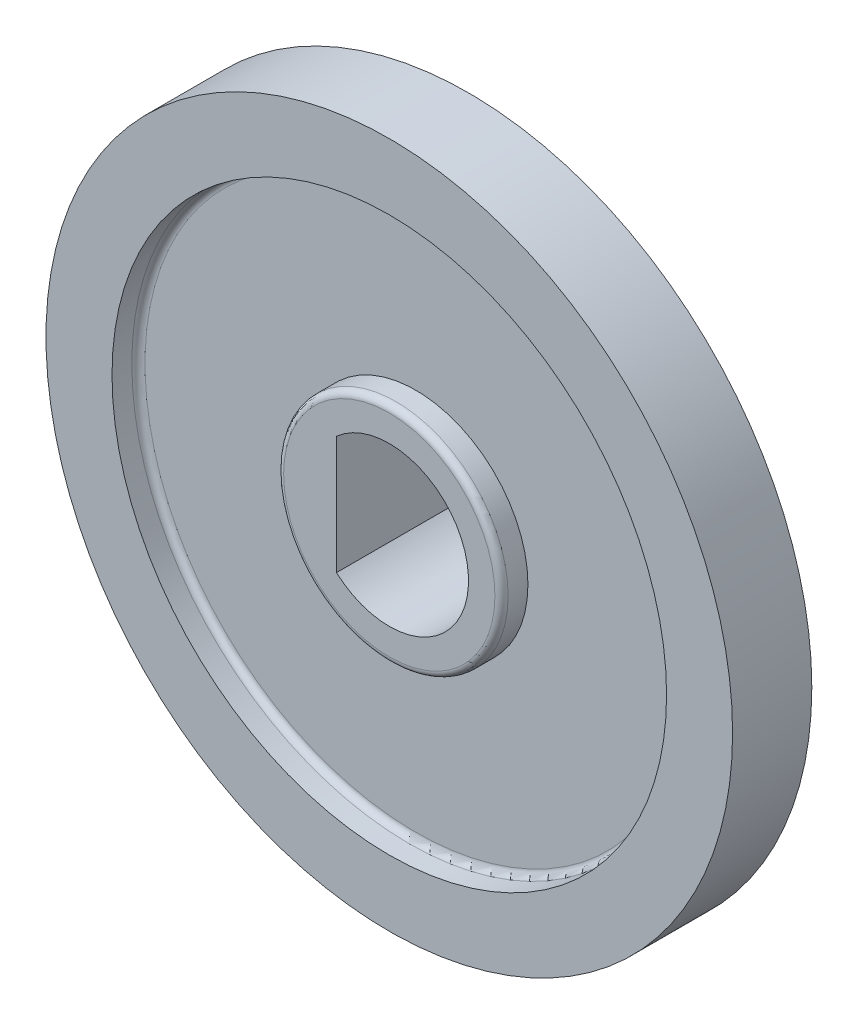
from build123d import *

# Parameters (mm, degrees)
BOSS_EXTRU_1_DEPTH      = 3
ESQUISSE2_R             = 10.5
ESQUISSE2_R_2           = 4.25
ENL_V_MAT_EXTRU_1_DEPTH = 1
ESQUISSE3_R             = 4.25
BOSS_EXTRU_2_DEPTH      = 3.3
BOSS_EXTRU_3_DEPTH      = 1.75
CONG_1_R                = 0.25
BOSS_EXTRU_4_START      = -3
ESQUISSE5_R             = 13
ESQUISSE5_R_2           = 11.875
BOSS_EXTRU_4_DEPTH      = 3


with BuildPart() as part:
    # Esquisse1 → Boss.-Extru.1 (new body)
    with BuildSketch(Plane.XY):
        with BuildLine():
            ThreePointArc((12.99358489, 0.408352439), (12.986055843, 0.601958181), (12.975642211, 0.795430209))
            add(Edge.make_bspline(
                [(11.825183943, 1.086577062), (11.84274004, 1.085334297), (12.058734776, 1.065812313), (12.434577724, 0.990975057), (12.793560897, 0.867739829), (12.961964929, 0.800917402), (12.975642211, 0.795430209)],
                knots=[0.129627803, 0.129627803, 0.129627803, 0.129627803, 0.182246376, 0.777177078, 1.275526536, 1.319644943, 1.319644943, 1.319644943, 1.319644943], degree=3))
            ThreePointArc((11.825183943, 1.086577062), (11.804328734, 1.29361824), (11.779848826, 1.500262192))
            add(Edge.make_bspline(
                [(11.779848826, 1.500262192), (11.796719089, 1.505277688), (12.003359366, 1.571115594), (12.354074026, 1.725575182), (12.677847228, 1.923632631), (12.827782192, 2.025341339), (12.83994646, 2.033660468)],
                knots=[0.129627803, 0.129627803, 0.129627803, 0.129627803, 0.182246376, 0.777177078, 1.275526536, 1.319644943, 1.319644943, 1.319644943, 1.319644943], degree=3))
            ThreePointArc((12.83994646, 2.033660468), (12.808211548, 2.22479593), (12.773631556, 2.415437201))
            add(Edge.make_bspline(
                [(11.595754619, 2.560097618), (11.61332804, 2.561065016), (11.830066347, 2.568768287), (12.212325257, 2.541626756), (12.58392321, 2.464355798), (12.759374396, 2.419166907), (12.773631556, 2.415437201)],
                knots=[0.129627803, 0.129627803, 0.129627803, 0.129627803, 0.182246376, 0.777177078, 1.275526536, 1.319644943, 1.319644943, 1.319644943, 1.319644943], degree=3))
            ThreePointArc((11.595754619, 2.560097618), (11.549114719, 2.762892364), (11.498928487, 2.964838721))
            add(Edge.make_bspline(
                [(11.498928487, 2.964838721), (11.515037115, 2.971929073), (11.711796295, 3.063146721), (12.040386545, 3.260344552), (12.336783518, 3.497419801), (12.472788719, 3.617118339), (12.483814405, 3.626896456)],
                knots=[0.129627803, 0.129627803, 0.129627803, 0.129627803, 0.182246376, 0.777177078, 1.275526536, 1.319644943, 1.319644943, 1.319644943, 1.319644943], degree=3))
            ThreePointArc((12.483814405, 3.626896456), (12.428374107, 3.81254732), (12.370173101, 3.997351304))
            add(Edge.make_bspline(
                [(11.183453318, 3.993243906), (11.20076692, 3.996406209), (11.414830705, 4.03121325), (11.797477125, 4.052195484), (12.175829536, 4.022107403), (12.355560907, 3.999264705), (12.370173101, 3.997351304)],
                knots=[0.129627803, 0.129627803, 0.129627803, 0.129627803, 0.182246376, 0.777177078, 1.275526536, 1.319644943, 1.319644943, 1.319644943, 1.319644943], degree=3))
            ThreePointArc((11.183453318, 3.993243906), (11.111764266, 4.188594025), (11.036663178, 4.382657972))
            add(Edge.make_bspline(
                [(11.036663178, 4.382657972), (11.051756128, 4.391711361), (11.235531199, 4.506870195), (11.536814975, 4.74369634), (11.801161363, 5.016050571), (11.921091917, 5.151851223), (11.930805139, 5.162934121)],
                knots=[0.129627803, 0.129627803, 0.129627803, 0.129627803, 0.182246376, 0.777177078, 1.275526536, 1.319644943, 1.319644943, 1.319644943, 1.319644943], degree=3))
            ThreePointArc((11.930805139, 5.162934121), (11.852533781, 5.34017256), (11.771629627, 5.51622479))
            add(Edge.make_bspline(
                [(10.594782277, 5.363414352), (10.611563014, 5.368721689), (10.819576363, 5.430083573), (11.196575731, 5.498858668), (11.575715757, 5.516427972), (11.756892842, 5.516291709), (11.771629627, 5.51622479)],
                knots=[0.129627803, 0.129627803, 0.129627803, 0.129627803, 0.182246376, 0.777177078, 1.275526536, 1.319644943, 1.319644943, 1.319644943, 1.319644943], degree=3))
            ThreePointArc((10.594782277, 5.363414352), (10.499174652, 5.548239056), (10.400343097, 5.731360089))
            add(Edge.make_bspline(
                [(10.400343097, 5.731360089), (10.414182344, 5.742233737), (10.582075065, 5.879517634), (10.851300942, 6.152237204), (11.079427843, 6.455575228), (11.181392374, 6.605336334), (11.189639949, 6.61754923)],
                knots=[0.129627803, 0.129627803, 0.129627803, 0.129627803, 0.182246376, 0.777177078, 1.275526536, 1.319644943, 1.319644943, 1.319644943, 1.319644943], degree=3))
            ThreePointArc((11.189639949, 6.61754923), (11.089771917, 6.783580089), (10.987440521, 6.948104115))
            add(Edge.make_bspline(
                [(9.83902519, 6.649000549), (9.855008421, 6.65636922), (10.053690839, 6.743318233), (10.419097649, 6.858801566), (10.793046025, 6.923751176), (10.972811553, 6.946323498), (10.987440521, 6.948104115)],
                knots=[0.129627803, 0.129627803, 0.129627803, 0.129627803, 0.182246376, 0.777177078, 1.275526536, 1.319644943, 1.319644943, 1.319644943, 1.319644943], degree=3))
            ThreePointArc((9.83902519, 6.649000549), (9.721006783, 6.820385043), (9.600003392, 6.989675233))
            add(Edge.make_bspline(
                [(9.600003392, 6.989675233), (9.612370683, 7.002197657), (9.761733286, 7.159441567), (9.994655411, 7.463753611), (10.182965127, 7.793291607), (10.265355594, 7.954651347), (10.272007452, 7.967801635)],
                knots=[0.129627803, 0.129627803, 0.129627803, 0.129627803, 0.182246376, 0.777177078, 1.275526536, 1.319644943, 1.319644943, 1.319644943, 1.319644943], degree=3))
            ThreePointArc((10.272007452, 7.967801635), (10.152117726, 8.120006508), (10.029972915, 8.270407688))
            add(Edge.make_bspline(
                [(8.928100799, 7.829728036), (8.943034458, 7.839041833), (9.129252605, 7.950206737), (9.477304173, 8.110577067), (9.84016351, 8.221882688), (10.015682471, 8.266807616), (10.029972915, 8.270407688)],
                knots=[0.129627803, 0.129627803, 0.129627803, 0.129627803, 0.182246376, 0.777177078, 1.275526536, 1.319644943, 1.319644943, 1.319644943, 1.319644943], degree=3))
            ThreePointArc((8.928100799, 7.829728036), (8.789532829, 7.984969483), (8.6482659, 8.137759024))
            add(Edge.make_bspline(
                [(8.6482659, 8.137759024), (8.658966195, 8.151732737), (8.787443141, 8.326456829), (8.980388193, 8.657562166), (9.125910968, 9.008103121), (9.187428024, 9.178516755), (9.192379262, 9.192397049)],
                knots=[0.129627803, 0.129627803, 0.129627803, 0.129627803, 0.182246376, 0.777177078, 1.275526536, 1.319644943, 1.319644943, 1.319644943, 1.319644943], degree=3))
            ThreePointArc((9.192379262, 9.192397049), (9.054358573, 9.328375573), (8.914326644, 9.462281991))
            add(Edge.make_bspline(
                [(7.876374925, 8.886976035), (7.890023499, 8.898088073), (8.060840604, 9.031715731), (8.386047949, 9.234443921), (8.732095738, 9.390350199), (8.900600093, 9.456919239), (8.914326644, 9.462281991)],
                knots=[0.129627803, 0.129627803, 0.129627803, 0.129627803, 0.182246376, 0.777177078, 1.275526536, 1.319644943, 1.319644943, 1.319644943, 1.319644943], degree=3))
            ThreePointArc((7.876374925, 8.886976035), (7.719442692, 9.023626185), (7.560140088, 9.157505493))
            add(Edge.make_bspline(
                [(7.560140088, 9.157505493), (7.569004637, 9.172710122), (7.674569769, 9.362158894), (7.824494889, 9.714835793), (7.924935742, 10.080851468), (7.964609225, 10.257631471), (7.96778176, 10.272022869)],
                knots=[0.129627803, 0.129627803, 0.129627803, 0.129627803, 0.182246376, 0.777177078, 1.275526536, 1.319644943, 1.319644943, 1.319644943, 1.319644943], degree=3))
            ThreePointArc((7.96778176, 10.272022869), (7.813806777, 10.389630583), (7.658096117, 10.504930455))
            add(Edge.make_bspline(
                [(6.700433913, 9.804071112), (6.712582157, 9.816806149), (6.865304331, 9.970789173), (7.16253874, 10.212678079), (7.486317601, 10.410726278), (7.645149935, 10.497889597), (7.658096117, 10.504930455)],
                knots=[0.129627803, 0.129627803, 0.129627803, 0.129627803, 0.182246376, 0.777177078, 1.275526536, 1.319644943, 1.319644943, 1.319644943, 1.319644943], degree=3))
            ThreePointArc((6.700433913, 9.804071112), (6.527612333, 9.919974911), (6.35278635, 10.03283263))
            add(Edge.make_bspline(
                [(6.35278635, 10.03283263), (6.359675355, 10.049028389), (6.440663846, 10.25021412), (6.545204626, 10.618900656), (6.598979545, 10.994618766), (6.616183782, 11.174977212), (6.617527579, 11.189652753)],
                knots=[0.129627803, 0.129627803, 0.129627803, 0.129627803, 0.182246376, 0.777177078, 1.275526536, 1.319644943, 1.319644943, 1.319644943, 1.319644943], degree=3))
            ThreePointArc((6.617527579, 11.189652753), (6.45002658, 11.287034913), (6.28109284, 11.38190989))
            add(Edge.make_bspline(
                [(5.418823056, 10.566550132), (5.429279383, 10.580707328), (5.561498107, 10.752617314), (5.826072015, 11.029852203), (6.122475762, 11.266918984), (6.269131196, 11.373301964), (6.28109284, 11.38190989)],
                knots=[0.129627803, 0.129627803, 0.129627803, 0.129627803, 0.182246376, 0.777177078, 1.275526536, 1.319644943, 1.319644943, 1.319644943, 1.319644943], degree=3))
            ThreePointArc((5.418823056, 10.566550132), (5.232837628, 10.659879707), (5.045245377, 10.749936004))
            add(Edge.make_bspline(
                [(5.045245377, 10.749936004), (5.050050193, 10.766867475), (5.105184808, 10.976617346), (5.162692576, 11.355499113), (5.168953499, 11.734994358), (5.163417168, 11.916086886), (5.162911036, 11.930815129)],
                knots=[0.129627803, 0.129627803, 0.129627803, 0.129627803, 0.182246376, 0.777177078, 1.275526536, 1.319644943, 1.319644943, 1.319644943, 1.319644943], degree=3))
            ThreePointArc((5.162911036, 11.930815129), (4.984525611, 12.006435959), (4.805032976, 12.079389806))
            add(Edge.make_bspline(
                [(4.051754122, 11.162388344), (4.060353631, 11.177744431), (4.169983736, 11.364870256), (4.397724655, 11.673078969), (4.662078824, 11.945425647), (4.794244512, 12.069350565), (4.805032976, 12.079389806)],
                knots=[0.129627803, 0.129627803, 0.129627803, 0.129627803, 0.182246376, 0.777177078, 1.275526536, 1.319644943, 1.319644943, 1.319644943, 1.319644943], degree=3))
            ThreePointArc((4.051754122, 11.162388344), (3.855537947, 11.231671832), (3.65813787, 11.297506465))
            add(Edge.make_bspline(
                [(3.65813787, 11.297506465), (3.660782722, 11.31490663), (3.689193955, 11.52991276), (3.698761781, 11.913014565), (3.657409968, 12.290302078), (3.62922038, 12.469272751), (3.626872301, 12.483821423)],
                knots=[0.129627803, 0.129627803, 0.129627803, 0.129627803, 0.182246376, 0.777177078, 1.275526536, 1.319644943, 1.319644943, 1.319644943, 1.319644943], degree=3))
            ThreePointArc((3.626872301, 12.483821423), (3.440415695, 12.536488338), (3.253194872, 12.58637053))
            add(Edge.make_bspline(
                [(2.620786605, 11.582189023), (2.627393676, 11.598501828), (2.712706231, 11.797892405), (2.90002255, 12.132214306), (3.128158117, 12.435545812), (3.243749729, 12.575058298), (3.253194872, 12.58637053)],
                knots=[0.129627803, 0.129627803, 0.129627803, 0.129627803, 0.182246376, 0.777177078, 1.275526536, 1.319644943, 1.319644943, 1.319644943, 1.319644943], degree=3))
            ThreePointArc((2.620786605, 11.582189023), (2.417434129, 11.626333783), (2.213339344, 11.6669085))
            add(Edge.make_bspline(
                [(2.213339344, 11.6669085), (2.213782522, 11.684502947), (2.21502231, 11.901374562), (2.176499302, 12.282654661), (2.088186897, 12.651784393), (2.037788619, 12.825810737), (2.033635623, 12.839950395)],
                knots=[0.129627803, 0.129627803, 0.129627803, 0.129627803, 0.182246376, 0.777177078, 1.275526536, 1.319644943, 1.319644943, 1.319644943, 1.319644943], degree=3))
            ThreePointArc((2.033635623, 12.839950395), (1.842048369, 12.868832807), (1.650051941, 12.894856672))
            add(Edge.make_bspline(
                [(1.148487718, 11.819331663), (1.152998154, 11.836343922), (1.212647728, 12.044854743), (1.356585356, 12.400017376), (1.544904488, 12.729549991), (1.642099075, 12.88244985), (1.650051941, 12.894856672)],
                knots=[0.129627803, 0.129627803, 0.129627803, 0.129627803, 0.182246376, 0.777177078, 1.275526536, 1.319644943, 1.319644943, 1.319644943, 1.319644943], degree=3))
            ThreePointArc((1.148487718, 11.819331663), (0.941205932, 11.837641505), (0.733635134, 11.852316419))
            add(Edge.make_bspline(
                [(0.733635134, 11.852316419), (0.731869648, 11.869827674), (0.70591844, 12.085144577), (0.61991213, 12.458589956), (0.486031871, 12.81374051), (0.414219715, 12.980078025), (0.408327297, 12.99358568)],
                knots=[0.129627803, 0.129627803, 0.129627803, 0.129627803, 0.182246376, 0.777177078, 1.275526536, 1.319644943, 1.319644943, 1.319644943, 1.319644943], degree=3))
            ThreePointArc((0.408327297, 12.99358568), (0.214630839, 12.998228095), (0.020886706, 12.999983221))
            add(Edge.make_bspline(
                [(-0.341923507, 11.870076382), (-0.339580838, 11.887519802), (-0.306534955, 12.101862526), (-0.208245998, 12.472264764), (-0.062713207, 12.822801562), (0.014551537, 12.986677472), (0.020886706, 12.999983221)],
                knots=[0.129627803, 0.129627803, 0.129627803, 0.129627803, 0.182246376, 0.777177078, 1.275526536, 1.319644943, 1.319644943, 1.319644943, 1.319644943], degree=3))
            ThreePointArc((-0.341923507, 11.870076382), (-0.549865646, 11.862262549), (-0.75763894, 11.850806227))
            add(Edge.make_bspline(
                [(-0.75763894, 11.850806227), (-0.761585246, 11.867958127), (-0.814318186, 12.078324643), (-0.946451427, 12.438045845), (-1.123788168, 12.773616285), (-1.215881682, 12.929641729), (-1.223420594, 12.942304356)],
                knots=[0.129627803, 0.129627803, 0.129627803, 0.129627803, 0.182246376, 0.777177078, 1.275526536, 1.319644943, 1.319644943, 1.319644943, 1.319644943], degree=3))
            ThreePointArc((-1.223420594, 12.942304356), (-1.416171547, 12.922633561), (-1.608607925, 12.900092269))
            add(Edge.make_bspline(
                [(-1.826942393, 11.733622906), (-1.826804438, 11.751222393), (-1.820883398, 11.968016709), (-1.769793189, 12.347817087), (-1.669341878, 12.713829893), (-1.613225487, 12.886097433), (-1.608607925, 12.900092269)],
                knots=[0.129627803, 0.129627803, 0.129627803, 0.129627803, 0.182246376, 0.777177078, 1.275526536, 1.319644943, 1.319644943, 1.319644943, 1.319644943], degree=3))
            ThreePointArc((-1.826942393, 11.733622906), (-2.032265513, 11.699808626), (-2.236964595, 11.662401742))
            add(Edge.make_bspline(
                [(-2.236964595, 11.662401742), (-2.243029487, 11.67892379), (-2.321712527, 11.881022314), (-2.49788888, 12.221346321), (-2.715885396, 12.5320445), (-2.826807899, 12.675297259), (-2.835874412, 12.686915162)],
                knots=[0.129627803, 0.129627803, 0.129627803, 0.129627803, 0.182246376, 0.777177078, 1.275526536, 1.319644943, 1.319644943, 1.319644943, 1.319644943], degree=3))
            ThreePointArc((-2.835874412, 12.686915162), (-3.024640061, 12.643241376), (-3.212733849, 12.596759155))
            add(Edge.make_bspline(
                [(-3.283149307, 11.412123187), (-3.28521824, 11.429601187), (-3.306515422, 11.645428118), (-3.303429684, 12.028636958), (-3.24964403, 12.404353531), (-3.215560981, 12.582295939), (-3.212733849, 12.596759155)],
                knots=[0.129627803, 0.129627803, 0.129627803, 0.129627803, 0.182246376, 0.777177078, 1.275526536, 1.319644943, 1.319644943, 1.319644943, 1.319644943], degree=3))
            ThreePointArc((-3.283149307, 11.412123187), (-3.48261534, 11.352841732), (-3.681011983, 11.290074215))
            add(Edge.make_bspline(
                [(-3.681011983, 11.290074215), (-3.689099813, 11.305705849), (-3.792492075, 11.496349166), (-4.009933133, 11.811908864), (-4.265151488, 12.092834888), (-4.393153666, 12.22105578), (-4.403604797, 12.231445736)],
                knots=[0.129627803, 0.129627803, 0.129627803, 0.129627803, 0.182246376, 0.777177078, 1.275526536, 1.319644943, 1.319644943, 1.319644943, 1.319644943], degree=3))
            ThreePointArc((-4.403604797, 12.231445736), (-4.585408195, 12.164457722), (-4.76619304, 12.094767625))
            add(Edge.make_bspline(
                [(-4.687578995, 10.910647468), (-4.691822188, 10.927728343), (-4.740001722, 11.13918417), (-4.78496912, 11.519758039), (-4.778697355, 11.899253104), (-4.767185158, 12.080064121), (-4.76619304, 12.094767625)],
                knots=[0.129627803, 0.129627803, 0.129627803, 0.129627803, 0.182246376, 0.777177078, 1.275526536, 1.319644943, 1.319644943, 1.319644943, 1.319644943], degree=3))
            ThreePointArc((-4.687578995, 10.910647468), (-4.878042242, 10.826833742), (-5.067007613, 10.739695473))
            add(Edge.make_bspline(
                [(-5.067007613, 10.739695473), (-5.076990831, 10.754190173), (-5.203461758, 10.930371724), (-5.458738345, 11.216190549), (-5.747153595, 11.462914045), (-5.890216776, 11.57408095), (-5.901887703, 11.583079105)],
                knots=[0.129627803, 0.129627803, 0.129627803, 0.129627803, 0.182246376, 0.777177078, 1.275526536, 1.319644943, 1.319644943, 1.319644943, 1.319644943], degree=3))
            ThreePointArc((-5.901887703, 11.583079105), (-6.073861703, 11.493833304), (-6.24448652, 11.402034384))
            add(Edge.make_bspline(
                [(-6.018082762, 10.237104321), (-6.024433298, 10.253518695), (-6.098735364, 10.457268632), (-6.191046734, 10.829205653), (-6.232387767, 11.206494348), (-6.243627977, 11.387322477), (-6.24448652, 11.402034384)],
                knots=[0.129627803, 0.129627803, 0.129627803, 0.129627803, 0.182246376, 0.777177078, 1.275526536, 1.319644943, 1.319644943, 1.319644943, 1.319644943], degree=3))
            ThreePointArc((-6.018082762, 10.237104321), (-6.196539504, 10.130080117), (-6.373093505, 10.019945318))
            add(Edge.make_bspline(
                [(-6.373093505, 10.019945318), (-6.38481467, 10.033074494), (-6.53236974, 10.19201579), (-6.821455993, 10.443586208), (-7.138519655, 10.6522162), (-7.294387648, 10.74457595), (-7.307094314, 10.752040396)],
                knots=[0.129627803, 0.129627803, 0.129627803, 0.129627803, 0.182246376, 0.777177078, 1.275526536, 1.319644943, 1.319644943, 1.319644943, 1.319644943], degree=3))
            ThreePointArc((-7.307094314, 10.752040396), (-7.466526783, 10.641944268), (-7.624300717, 10.52948425))
            add(Edge.make_bspline(
                [(-7.253677769, 9.402115923), (-7.262035495, 9.417604932), (-7.361288306, 9.610435722), (-7.499487843, 9.967870226), (-7.587789702, 10.337002481), (-7.621605054, 10.514995954), (-7.624300717, 10.52948425)],
                knots=[0.129627803, 0.129627803, 0.129627803, 0.129627803, 0.182246376, 0.777177078, 1.275526536, 1.319644943, 1.319644943, 1.319644943, 1.319644943], degree=3))
            ThreePointArc((-7.253677769, 9.402115923), (-7.417313637, 9.273569076), (-7.578671906, 9.142174639))
            add(Edge.make_bspline(
                [(-7.578671906, 9.142174639), (-7.591946169, 9.153731237), (-7.758258349, 9.292925679), (-8.076595204, 9.506280274), (-8.417306997, 9.673526543), (-8.58352167, 9.745622569), (-8.597063683, 9.751435588)],
                knots=[0.129627803, 0.129627803, 0.129627803, 0.129627803, 0.182246376, 0.777177078, 1.275526536, 1.319644943, 1.319644943, 1.319644943, 1.319644943], degree=3))
            ThreePointArc((-8.597063683, 9.751435588), (-8.741440276, 9.622225413), (-8.883875138, 9.490877859))
            add(Edge.make_bspline(
                [(-8.374877944, 8.418850541), (-8.385111055, 8.433169913), (-8.507749334, 8.612040499), (-8.689657548, 8.949335531), (-8.82352766, 9.30448991), (-8.879384865, 9.476841664), (-8.883875138, 9.490877859)],
                knots=[0.129627803, 0.129627803, 0.129627803, 0.129627803, 0.182246376, 0.777177078, 1.275526536, 1.319644943, 1.319644943, 1.319644943, 1.319644943], degree=3))
            ThreePointArc((-8.374877944, 8.418850541), (-8.521112302, 8.270808312), (-8.664730124, 8.120226406))
            add(Edge.make_bspline(
                [(-8.664730124, 8.120226406), (-8.679348141, 8.130028169), (-8.861794589, 8.247280579), (-9.204361685, 8.419054622), (-9.563348378, 8.542279593), (-9.737288428, 8.592974898), (-9.751452223, 8.597044815)],
                knots=[0.129627803, 0.129627803, 0.129627803, 0.129627803, 0.182246376, 0.777177078, 1.275526536, 1.319644943, 1.319644943, 1.319644943, 1.319644943], degree=3))
            ThreePointArc((-9.751452223, 8.597044815), (-9.878496034, 8.450758316), (-10.00334554, 8.302594655))
            add(Edge.make_bspline(
                [(-9.364001291, 7.302814856), (-9.375948404, 7.315738767), (-9.520038073, 7.477828253), (-9.742786163, 7.789664468), (-9.920113316, 8.125239975), (-9.997131473, 8.28923192), (-10.00334554, 8.302594655)],
                knots=[0.129627803, 0.129627803, 0.129627803, 0.129627803, 0.182246376, 0.777177078, 1.275526536, 1.319644943, 1.319644943, 1.319644943, 1.319644943], degree=3))
            ThreePointArc((-9.364001291, 7.302814856), (-9.490527937, 7.137611959), (-9.614140372, 6.970217351))
            add(Edge.make_bspline(
                [(-9.614140372, 6.970217351), (-9.629871608, 6.978109701), (-9.825575035, 7.071570937), (-10.186969883, 7.199055449), (-10.558570043, 7.276315791), (-10.73749233, 7.304810879), (-10.752054535, 7.30707351)],
                knots=[0.129627803, 0.129627803, 0.129627803, 0.129627803, 0.182246376, 0.777177078, 1.275526536, 1.319644943, 1.319644943, 1.319644943, 1.319644943], degree=3))
            ThreePointArc((-10.752054535, 7.30707351), (-10.859762008, 7.146017712), (-10.965057208, 6.983374573))
            add(Edge.make_bspline(
                [(-10.205448744, 6.071609419), (-10.218921446, 6.082934051), (-10.382190124, 6.225686188), (-10.642265221, 6.507145743), (-10.860252859, 6.817850151), (-10.957217346, 6.970896036), (-10.965057208, 6.983374573)],
                knots=[0.129627803, 0.129627803, 0.129627803, 0.129627803, 0.182246376, 0.777177078, 1.275526536, 1.319644943, 1.319644943, 1.319644943, 1.319644943], degree=3))
            ThreePointArc((-10.205448744, 6.071609419), (-10.310272276, 5.891851203), (-10.411929882, 5.710283804))
            add(Edge.make_bspline(
                [(-10.411929882, 5.710283804), (-10.428526247, 5.716142275), (-10.634400293, 5.784338398), (-11.008923481, 5.865522871), (-11.387276751, 5.895600142), (-11.568359564, 5.90144563), (-11.583090524, 5.90186529)],
                knots=[0.129627803, 0.129627803, 0.129627803, 0.129627803, 0.182246376, 0.777177078, 1.275526536, 1.319644943, 1.319644943, 1.319644943, 1.319644943], degree=3))
            ThreePointArc((-11.583090524, 5.90186529), (-11.669763047, 5.72858014), (-11.753843373, 5.554022503))
            add(Edge.make_bspline(
                [(-10.885950174, 4.744651074), (-10.900735992, 4.754197831), (-11.080608835, 4.875361334), (-11.373909398, 5.122005443), (-11.629119727, 5.402938758), (-11.744501355, 5.542624958), (-11.753843373, 5.554022503)],
                knots=[0.129627803, 0.129627803, 0.129627803, 0.129627803, 0.182246376, 0.777177078, 1.275526536, 1.319644943, 1.319644943, 1.319644943, 1.319644943], degree=3))
            ThreePointArc((-10.885950174, 4.744651074), (-10.967417462, 4.553172433), (-11.045517039, 4.360295671))
            add(Edge.make_bspline(
                [(-11.045517039, 4.360295671), (-11.062716797, 4.36402787), (-11.275514706, 4.405883386), (-11.657259779, 4.439487493), (-12.036399302, 4.421907357), (-12.216786857, 4.405011057), (-12.231454257, 4.40358113)],
                knots=[0.129627803, 0.129627803, 0.129627803, 0.129627803, 0.182246376, 0.777177078, 1.275526536, 1.319644943, 1.319644943, 1.319644943, 1.319644943], degree=3))
            ThreePointArc((-12.231454257, 4.40358113), (-12.295724953, 4.220799436), (-12.357264407, 4.03708018))
            add(Edge.make_bspline(
                [(-11.394773666, 3.342866747), (-11.41063942, 3.35048507), (-11.604279725, 3.448149118), (-11.926180229, 3.656088057), (-12.21458843, 3.902819794), (-12.346567563, 4.026943374), (-12.357264407, 4.03708018)],
                knots=[0.129627803, 0.129627803, 0.129627803, 0.129627803, 0.182246376, 0.777177078, 1.275526536, 1.319644943, 1.319644943, 1.319644943, 1.319644943], degree=3))
            ThreePointArc((-11.394773666, 3.342866747), (-11.451599924, 3.142687414), (-11.504909794, 2.94154307))
            add(Edge.make_bspline(
                [(-11.504909794, 2.94154307), (-11.522441695, 2.943090138), (-11.738807516, 2.957944961), (-12.121754126, 2.943438745), (-12.495700646, 2.878478452), (-12.672548123, 2.839106828), (-12.686920649, 2.835849864)],
                knots=[0.129627803, 0.129627803, 0.129627803, 0.129627803, 0.182246376, 0.777177078, 1.275526536, 1.319644943, 1.319644943, 1.319644943, 1.319644943], degree=3))
            ThreePointArc((-12.686920649, 2.835849864), (-12.727775931, 2.646454205), (-12.765803999, 2.456470691))
            add(Edge.make_bspline(
                [(-11.723894771, 1.888363415), (-11.740590248, 1.893933159), (-11.944944193, 1.966557531), (-12.290368075, 2.132511978), (-12.607425776, 2.341151029), (-12.753921024, 2.447754486), (-12.765803999, 2.456470691)],
                knots=[0.129627803, 0.129627803, 0.129627803, 0.129627803, 0.182246376, 0.777177078, 1.275526536, 1.319644943, 1.319644943, 1.319644943, 1.319644943], degree=3))
            ThreePointArc((-11.723894771, 1.888363415), (-11.755183814, 1.682640337), (-11.782863248, 1.476400578))
            add(Edge.make_bspline(
                [(-11.782863248, 1.476400578), (-11.800450805, 1.475738117), (-12.016972319, 1.463357978), (-12.39508117, 1.400970211), (-12.757937327, 1.289654222), (-12.928455735, 1.228428189), (-12.942306723, 1.223395552)],
                knots=[0.129627803, 0.129627803, 0.129627803, 0.129627803, 0.182246376, 0.777177078, 1.275526536, 1.319644943, 1.319644943, 1.319644943, 1.319644943], degree=3))
            ThreePointArc((-12.942306723, 1.223395552), (-12.959102279, 1.03037281), (-12.973019237, 0.837121191))
            add(Edge.make_bspline(
                [(-11.868123052, 0.404079464), (-11.885384954, 0.407512791), (-12.097229754, 0.453952157), (-12.460729473, 0.575304912), (-12.801436487, 0.742560915), (-12.960137532, 0.829963048), (-12.973019237, 0.837121191)],
                knots=[0.129627803, 0.129627803, 0.129627803, 0.129627803, 0.182246376, 0.777177078, 1.275526536, 1.319644943, 1.319644943, 1.319644943, 1.319644943], degree=3))
            ThreePointArc((-11.868123052, 0.404079464), (-11.873381433, 0.196057017), (-11.874993911, -0.012025633))
            add(Edge.make_bspline(
                [(-11.874993911, -0.012025633), (-11.892359755, -0.014887175), (-12.10562229, -0.054307035), (-12.47293038, -0.163592461), (-12.818973714, -0.319508626), (-12.980473877, -0.401623496), (-12.99358489, -0.408352439)],
                knots=[0.129627803, 0.129627803, 0.129627803, 0.129627803, 0.182246376, 0.777177078, 1.275526536, 1.319644943, 1.319644943, 1.319644943, 1.319644943], degree=3))
            ThreePointArc((-12.99358489, -0.408352439), (-12.986055843, -0.601958181), (-12.975642211, -0.795430209))
            add(Edge.make_bspline(
                [(-11.825183943, -1.086577062), (-11.84274004, -1.085334297), (-12.058734776, -1.065812313), (-12.434577724, -0.990975057), (-12.793560897, -0.867739829), (-12.961964929, -0.800917402), (-12.975642211, -0.795430209)],
                knots=[0.129627803, 0.129627803, 0.129627803, 0.129627803, 0.182246376, 0.777177078, 1.275526536, 1.319644943, 1.319644943, 1.319644943, 1.319644943], degree=3))
            ThreePointArc((-11.825183943, -1.086577062), (-11.804328734, -1.29361824), (-11.779848826, -1.500262192))
            add(Edge.make_bspline(
                [(-11.779848826, -1.500262192), (-11.796719089, -1.505277688), (-12.003359366, -1.571115594), (-12.354074026, -1.725575182), (-12.677847228, -1.923632631), (-12.827782192, -2.025341339), (-12.83994646, -2.033660468)],
                knots=[0.129627803, 0.129627803, 0.129627803, 0.129627803, 0.182246376, 0.777177078, 1.275526536, 1.319644943, 1.319644943, 1.319644943, 1.319644943], degree=3))
            ThreePointArc((-12.83994646, -2.033660468), (-12.808211548, -2.22479593), (-12.773631556, -2.415437201))
            add(Edge.make_bspline(
                [(-11.595754619, -2.560097618), (-11.61332804, -2.561065016), (-11.830066347, -2.568768287), (-12.212325257, -2.541626756), (-12.58392321, -2.464355798), (-12.759374396, -2.419166907), (-12.773631556, -2.415437201)],
                knots=[0.129627803, 0.129627803, 0.129627803, 0.129627803, 0.182246376, 0.777177078, 1.275526536, 1.319644943, 1.319644943, 1.319644943, 1.319644943], degree=3))
            ThreePointArc((-11.595754619, -2.560097618), (-11.549114719, -2.762892364), (-11.498928487, -2.964838721))
            add(Edge.make_bspline(
                [(-11.498928487, -2.964838721), (-11.515037115, -2.971929073), (-11.711796295, -3.063146721), (-12.040386545, -3.260344552), (-12.336783518, -3.497419801), (-12.472788719, -3.617118339), (-12.483814405, -3.626896456)],
                knots=[0.129627803, 0.129627803, 0.129627803, 0.129627803, 0.182246376, 0.777177078, 1.275526536, 1.319644943, 1.319644943, 1.319644943, 1.319644943], degree=3))
            ThreePointArc((-12.483814405, -3.626896456), (-12.428374107, -3.81254732), (-12.370173101, -3.997351304))
            add(Edge.make_bspline(
                [(-11.183453318, -3.993243906), (-11.20076692, -3.996406209), (-11.414830705, -4.03121325), (-11.797477125, -4.052195484), (-12.175829536, -4.022107403), (-12.355560907, -3.999264705), (-12.370173101, -3.997351304)],
                knots=[0.129627803, 0.129627803, 0.129627803, 0.129627803, 0.182246376, 0.777177078, 1.275526536, 1.319644943, 1.319644943, 1.319644943, 1.319644943], degree=3))
            ThreePointArc((-11.183453318, -3.993243906), (-11.111764266, -4.188594025), (-11.036663178, -4.382657972))
            add(Edge.make_bspline(
                [(-11.036663178, -4.382657972), (-11.051756128, -4.391711361), (-11.235531199, -4.506870195), (-11.536814975, -4.74369634), (-11.801161363, -5.016050571), (-11.921091917, -5.151851223), (-11.930805139, -5.162934121)],
                knots=[0.129627803, 0.129627803, 0.129627803, 0.129627803, 0.182246376, 0.777177078, 1.275526536, 1.319644943, 1.319644943, 1.319644943, 1.319644943], degree=3))
            ThreePointArc((-11.930805139, -5.162934121), (-11.852533781, -5.34017256), (-11.771629627, -5.51622479))
            add(Edge.make_bspline(
                [(-10.594782277, -5.363414352), (-10.611563014, -5.368721689), (-10.819576363, -5.430083573), (-11.196575731, -5.498858668), (-11.575715757, -5.516427972), (-11.756892842, -5.516291709), (-11.771629627, -5.51622479)],
                knots=[0.129627803, 0.129627803, 0.129627803, 0.129627803, 0.182246376, 0.777177078, 1.275526536, 1.319644943, 1.319644943, 1.319644943, 1.319644943], degree=3))
            ThreePointArc((-10.594782277, -5.363414352), (-10.499174652, -5.548239056), (-10.400343097, -5.731360089))
            add(Edge.make_bspline(
                [(-10.400343097, -5.731360089), (-10.414182344, -5.742233737), (-10.582075065, -5.879517634), (-10.851300942, -6.152237204), (-11.079427843, -6.455575228), (-11.181392374, -6.605336334), (-11.189639949, -6.61754923)],
                knots=[0.129627803, 0.129627803, 0.129627803, 0.129627803, 0.182246376, 0.777177078, 1.275526536, 1.319644943, 1.319644943, 1.319644943, 1.319644943], degree=3))
            ThreePointArc((-11.189639949, -6.61754923), (-11.089771917, -6.783580089), (-10.987440521, -6.948104115))
            add(Edge.make_bspline(
                [(-9.83902519, -6.649000549), (-9.855008421, -6.65636922), (-10.053690839, -6.743318233), (-10.419097649, -6.858801566), (-10.793046025, -6.923751176), (-10.972811553, -6.946323498), (-10.987440521, -6.948104115)],
                knots=[0.129627803, 0.129627803, 0.129627803, 0.129627803, 0.182246376, 0.777177078, 1.275526536, 1.319644943, 1.319644943, 1.319644943, 1.319644943], degree=3))
            ThreePointArc((-9.83902519, -6.649000549), (-9.721006783, -6.820385043), (-9.600003392, -6.989675233))
            add(Edge.make_bspline(
                [(-9.600003392, -6.989675233), (-9.612370683, -7.002197657), (-9.761733286, -7.159441567), (-9.994655411, -7.463753611), (-10.182965127, -7.793291607), (-10.265355594, -7.954651347), (-10.272007452, -7.967801635)],
                knots=[0.129627803, 0.129627803, 0.129627803, 0.129627803, 0.182246376, 0.777177078, 1.275526536, 1.319644943, 1.319644943, 1.319644943, 1.319644943], degree=3))
            ThreePointArc((-10.272007452, -7.967801635), (-10.152117726, -8.120006508), (-10.029972915, -8.270407688))
            add(Edge.make_bspline(
                [(-8.928100799, -7.829728036), (-8.943034458, -7.839041833), (-9.129252605, -7.950206737), (-9.477304173, -8.110577067), (-9.84016351, -8.221882688), (-10.015682471, -8.266807616), (-10.029972915, -8.270407688)],
                knots=[0.129627803, 0.129627803, 0.129627803, 0.129627803, 0.182246376, 0.777177078, 1.275526536, 1.319644943, 1.319644943, 1.319644943, 1.319644943], degree=3))
            ThreePointArc((-8.928100799, -7.829728036), (-8.789532829, -7.984969483), (-8.6482659, -8.137759024))
            add(Edge.make_bspline(
                [(-8.6482659, -8.137759024), (-8.658966195, -8.151732737), (-8.787443141, -8.326456829), (-8.980388193, -8.657562166), (-9.125910968, -9.008103121), (-9.187428024, -9.178516755), (-9.192379262, -9.192397049)],
                knots=[0.129627803, 0.129627803, 0.129627803, 0.129627803, 0.182246376, 0.777177078, 1.275526536, 1.319644943, 1.319644943, 1.319644943, 1.319644943], degree=3))
            ThreePointArc((-9.192379262, -9.192397049), (-9.054358573, -9.328375573), (-8.914326644, -9.462281991))
            add(Edge.make_bspline(
                [(-7.876374925, -8.886976035), (-7.890023499, -8.898088073), (-8.060840604, -9.031715731), (-8.386047949, -9.234443921), (-8.732095738, -9.390350199), (-8.900600093, -9.456919239), (-8.914326644, -9.462281991)],
                knots=[0.129627803, 0.129627803, 0.129627803, 0.129627803, 0.182246376, 0.777177078, 1.275526536, 1.319644943, 1.319644943, 1.319644943, 1.319644943], degree=3))
            ThreePointArc((-7.876374925, -8.886976035), (-7.719442692, -9.023626185), (-7.560140088, -9.157505493))
            add(Edge.make_bspline(
                [(-7.560140088, -9.157505493), (-7.569004637, -9.172710122), (-7.674569769, -9.362158894), (-7.824494889, -9.714835793), (-7.924935742, -10.080851468), (-7.964609225, -10.257631471), (-7.96778176, -10.272022869)],
                knots=[0.129627803, 0.129627803, 0.129627803, 0.129627803, 0.182246376, 0.777177078, 1.275526536, 1.319644943, 1.319644943, 1.319644943, 1.319644943], degree=3))
            ThreePointArc((-7.96778176, -10.272022869), (-7.813806777, -10.389630583), (-7.658096117, -10.504930455))
            add(Edge.make_bspline(
                [(-6.700433913, -9.804071112), (-6.712582157, -9.816806149), (-6.865304331, -9.970789173), (-7.16253874, -10.212678079), (-7.486317601, -10.410726278), (-7.645149935, -10.497889597), (-7.658096117, -10.504930455)],
                knots=[0.129627803, 0.129627803, 0.129627803, 0.129627803, 0.182246376, 0.777177078, 1.275526536, 1.319644943, 1.319644943, 1.319644943, 1.319644943], degree=3))
            ThreePointArc((-6.700433913, -9.804071112), (-6.527612333, -9.919974911), (-6.35278635, -10.03283263))
            add(Edge.make_bspline(
                [(-6.35278635, -10.03283263), (-6.359675355, -10.049028389), (-6.440663846, -10.25021412), (-6.545204626, -10.618900656), (-6.598979545, -10.994618766), (-6.616183782, -11.174977212), (-6.617527579, -11.189652753)],
                knots=[0.129627803, 0.129627803, 0.129627803, 0.129627803, 0.182246376, 0.777177078, 1.275526536, 1.319644943, 1.319644943, 1.319644943, 1.319644943], degree=3))
            ThreePointArc((-6.617527579, -11.189652753), (-6.45002658, -11.287034913), (-6.28109284, -11.38190989))
            add(Edge.make_bspline(
                [(-5.418823056, -10.566550132), (-5.429279383, -10.580707328), (-5.561498107, -10.752617314), (-5.826072015, -11.029852203), (-6.122475762, -11.266918984), (-6.269131196, -11.373301964), (-6.28109284, -11.38190989)],
                knots=[0.129627803, 0.129627803, 0.129627803, 0.129627803, 0.182246376, 0.777177078, 1.275526536, 1.319644943, 1.319644943, 1.319644943, 1.319644943], degree=3))
            ThreePointArc((-5.418823056, -10.566550132), (-5.232837628, -10.659879707), (-5.045245377, -10.749936004))
            add(Edge.make_bspline(
                [(-5.045245377, -10.749936004), (-5.050050193, -10.766867475), (-5.105184808, -10.976617346), (-5.162692576, -11.355499113), (-5.168953499, -11.734994358), (-5.163417168, -11.916086886), (-5.162911036, -11.930815129)],
                knots=[0.129627803, 0.129627803, 0.129627803, 0.129627803, 0.182246376, 0.777177078, 1.275526536, 1.319644943, 1.319644943, 1.319644943, 1.319644943], degree=3))
            ThreePointArc((-5.162911036, -11.930815129), (-4.984525611, -12.006435959), (-4.805032976, -12.079389806))
            add(Edge.make_bspline(
                [(-4.051754122, -11.162388344), (-4.060353631, -11.177744431), (-4.169983736, -11.364870256), (-4.397724655, -11.673078969), (-4.662078824, -11.945425647), (-4.794244512, -12.069350565), (-4.805032976, -12.079389806)],
                knots=[0.129627803, 0.129627803, 0.129627803, 0.129627803, 0.182246376, 0.777177078, 1.275526536, 1.319644943, 1.319644943, 1.319644943, 1.319644943], degree=3))
            ThreePointArc((-4.051754122, -11.162388344), (-3.855537947, -11.231671832), (-3.65813787, -11.297506465))
            add(Edge.make_bspline(
                [(-3.65813787, -11.297506465), (-3.660782722, -11.31490663), (-3.689193955, -11.52991276), (-3.698761781, -11.913014565), (-3.657409968, -12.290302078), (-3.62922038, -12.469272751), (-3.626872301, -12.483821423)],
                knots=[0.129627803, 0.129627803, 0.129627803, 0.129627803, 0.182246376, 0.777177078, 1.275526536, 1.319644943, 1.319644943, 1.319644943, 1.319644943], degree=3))
            ThreePointArc((-3.626872301, -12.483821423), (-3.440415695, -12.536488338), (-3.253194872, -12.58637053))
            add(Edge.make_bspline(
                [(-2.620786605, -11.582189023), (-2.627393676, -11.598501828), (-2.712706231, -11.797892405), (-2.90002255, -12.132214306), (-3.128158117, -12.435545812), (-3.243749729, -12.575058298), (-3.253194872, -12.58637053)],
                knots=[0.129627803, 0.129627803, 0.129627803, 0.129627803, 0.182246376, 0.777177078, 1.275526536, 1.319644943, 1.319644943, 1.319644943, 1.319644943], degree=3))
            ThreePointArc((-2.620786605, -11.582189023), (-2.417434129, -11.626333783), (-2.213339344, -11.6669085))
            add(Edge.make_bspline(
                [(-2.213339344, -11.6669085), (-2.213782522, -11.684502947), (-2.21502231, -11.901374562), (-2.176499302, -12.282654661), (-2.088186897, -12.651784393), (-2.037788619, -12.825810737), (-2.033635623, -12.839950395)],
                knots=[0.129627803, 0.129627803, 0.129627803, 0.129627803, 0.182246376, 0.777177078, 1.275526536, 1.319644943, 1.319644943, 1.319644943, 1.319644943], degree=3))
            ThreePointArc((-2.033635623, -12.839950395), (-1.842048369, -12.868832807), (-1.650051941, -12.894856672))
            add(Edge.make_bspline(
                [(-1.148487718, -11.819331663), (-1.152998154, -11.836343922), (-1.212647728, -12.044854743), (-1.356585356, -12.400017376), (-1.544904488, -12.729549991), (-1.642099075, -12.88244985), (-1.650051941, -12.894856672)],
                knots=[0.129627803, 0.129627803, 0.129627803, 0.129627803, 0.182246376, 0.777177078, 1.275526536, 1.319644943, 1.319644943, 1.319644943, 1.319644943], degree=3))
            ThreePointArc((-1.148487718, -11.819331663), (-0.941205932, -11.837641505), (-0.733635134, -11.852316419))
            add(Edge.make_bspline(
                [(-0.733635134, -11.852316419), (-0.731869648, -11.869827674), (-0.70591844, -12.085144577), (-0.61991213, -12.458589956), (-0.486031871, -12.81374051), (-0.414219715, -12.980078025), (-0.408327297, -12.99358568)],
                knots=[0.129627803, 0.129627803, 0.129627803, 0.129627803, 0.182246376, 0.777177078, 1.275526536, 1.319644943, 1.319644943, 1.319644943, 1.319644943], degree=3))
            ThreePointArc((-0.408327297, -12.99358568), (-0.214630839, -12.998228095), (-0.020886706, -12.999983221))
            add(Edge.make_bspline(
                [(0.341923507, -11.870076382), (0.339580838, -11.887519802), (0.306534955, -12.101862526), (0.208245998, -12.472264764), (0.062713207, -12.822801562), (-0.014551537, -12.986677472), (-0.020886706, -12.999983221)],
                knots=[0.129627803, 0.129627803, 0.129627803, 0.129627803, 0.182246376, 0.777177078, 1.275526536, 1.319644943, 1.319644943, 1.319644943, 1.319644943], degree=3))
            ThreePointArc((0.341923507, -11.870076382), (0.549865646, -11.862262549), (0.75763894, -11.850806227))
            add(Edge.make_bspline(
                [(0.75763894, -11.850806227), (0.761585246, -11.867958127), (0.814318186, -12.078324643), (0.946451427, -12.438045845), (1.123788168, -12.773616285), (1.215881682, -12.929641729), (1.223420594, -12.942304356)],
                knots=[0.129627803, 0.129627803, 0.129627803, 0.129627803, 0.182246376, 0.777177078, 1.275526536, 1.319644943, 1.319644943, 1.319644943, 1.319644943], degree=3))
            ThreePointArc((1.223420594, -12.942304356), (1.416171547, -12.922633561), (1.608607925, -12.900092269))
            add(Edge.make_bspline(
                [(1.826942393, -11.733622906), (1.826804438, -11.751222393), (1.820883398, -11.968016709), (1.769793189, -12.347817087), (1.669341878, -12.713829893), (1.613225487, -12.886097433), (1.608607925, -12.900092269)],
                knots=[0.129627803, 0.129627803, 0.129627803, 0.129627803, 0.182246376, 0.777177078, 1.275526536, 1.319644943, 1.319644943, 1.319644943, 1.319644943], degree=3))
            ThreePointArc((1.826942393, -11.733622906), (2.032265513, -11.699808626), (2.236964595, -11.662401742))
            add(Edge.make_bspline(
                [(2.236964595, -11.662401742), (2.243029487, -11.67892379), (2.321712527, -11.881022314), (2.49788888, -12.221346321), (2.715885396, -12.5320445), (2.826807899, -12.675297259), (2.835874412, -12.686915162)],
                knots=[0.129627803, 0.129627803, 0.129627803, 0.129627803, 0.182246376, 0.777177078, 1.275526536, 1.319644943, 1.319644943, 1.319644943, 1.319644943], degree=3))
            ThreePointArc((2.835874412, -12.686915162), (3.024640061, -12.643241376), (3.212733849, -12.596759155))
            add(Edge.make_bspline(
                [(3.283149307, -11.412123187), (3.28521824, -11.429601187), (3.306515422, -11.645428118), (3.303429684, -12.028636958), (3.24964403, -12.404353531), (3.215560981, -12.582295939), (3.212733849, -12.596759155)],
                knots=[0.129627803, 0.129627803, 0.129627803, 0.129627803, 0.182246376, 0.777177078, 1.275526536, 1.319644943, 1.319644943, 1.319644943, 1.319644943], degree=3))
            ThreePointArc((3.283149307, -11.412123187), (3.48261534, -11.352841732), (3.681011983, -11.290074215))
            add(Edge.make_bspline(
                [(3.681011983, -11.290074215), (3.689099813, -11.305705849), (3.792492075, -11.496349166), (4.009933133, -11.811908864), (4.265151488, -12.092834888), (4.393153666, -12.22105578), (4.403604797, -12.231445736)],
                knots=[0.129627803, 0.129627803, 0.129627803, 0.129627803, 0.182246376, 0.777177078, 1.275526536, 1.319644943, 1.319644943, 1.319644943, 1.319644943], degree=3))
            ThreePointArc((4.403604797, -12.231445736), (4.585408195, -12.164457722), (4.76619304, -12.094767625))
            add(Edge.make_bspline(
                [(4.687578995, -10.910647468), (4.691822188, -10.927728343), (4.740001722, -11.13918417), (4.78496912, -11.519758039), (4.778697355, -11.899253104), (4.767185158, -12.080064121), (4.76619304, -12.094767625)],
                knots=[0.129627803, 0.129627803, 0.129627803, 0.129627803, 0.182246376, 0.777177078, 1.275526536, 1.319644943, 1.319644943, 1.319644943, 1.319644943], degree=3))
            ThreePointArc((4.687578995, -10.910647468), (4.878042242, -10.826833742), (5.067007613, -10.739695473))
            add(Edge.make_bspline(
                [(5.067007613, -10.739695473), (5.076990831, -10.754190173), (5.203461758, -10.930371724), (5.458738345, -11.216190549), (5.747153595, -11.462914045), (5.890216776, -11.57408095), (5.901887703, -11.583079105)],
                knots=[0.129627803, 0.129627803, 0.129627803, 0.129627803, 0.182246376, 0.777177078, 1.275526536, 1.319644943, 1.319644943, 1.319644943, 1.319644943], degree=3))
            ThreePointArc((5.901887703, -11.583079105), (6.073861703, -11.493833304), (6.24448652, -11.402034384))
            add(Edge.make_bspline(
                [(6.018082762, -10.237104321), (6.024433298, -10.253518695), (6.098735364, -10.457268632), (6.191046734, -10.829205653), (6.232387767, -11.206494348), (6.243627977, -11.387322477), (6.24448652, -11.402034384)],
                knots=[0.129627803, 0.129627803, 0.129627803, 0.129627803, 0.182246376, 0.777177078, 1.275526536, 1.319644943, 1.319644943, 1.319644943, 1.319644943], degree=3))
            ThreePointArc((6.018082762, -10.237104321), (6.196539504, -10.130080117), (6.373093505, -10.019945318))
            add(Edge.make_bspline(
                [(6.373093505, -10.019945318), (6.38481467, -10.033074494), (6.53236974, -10.19201579), (6.821455993, -10.443586208), (7.138519655, -10.6522162), (7.294387648, -10.74457595), (7.307094314, -10.752040396)],
                knots=[0.129627803, 0.129627803, 0.129627803, 0.129627803, 0.182246376, 0.777177078, 1.275526536, 1.319644943, 1.319644943, 1.319644943, 1.319644943], degree=3))
            ThreePointArc((7.307094314, -10.752040396), (7.466526783, -10.641944268), (7.624300717, -10.52948425))
            add(Edge.make_bspline(
                [(7.253677769, -9.402115923), (7.262035495, -9.417604932), (7.361288306, -9.610435722), (7.499487843, -9.967870226), (7.587789702, -10.337002481), (7.621605054, -10.514995954), (7.624300717, -10.52948425)],
                knots=[0.129627803, 0.129627803, 0.129627803, 0.129627803, 0.182246376, 0.777177078, 1.275526536, 1.319644943, 1.319644943, 1.319644943, 1.319644943], degree=3))
            ThreePointArc((7.253677769, -9.402115923), (7.417313637, -9.273569076), (7.578671906, -9.142174639))
            add(Edge.make_bspline(
                [(7.578671906, -9.142174639), (7.591946169, -9.153731237), (7.758258349, -9.292925679), (8.076595204, -9.506280274), (8.417306997, -9.673526543), (8.58352167, -9.745622569), (8.597063683, -9.751435588)],
                knots=[0.129627803, 0.129627803, 0.129627803, 0.129627803, 0.182246376, 0.777177078, 1.275526536, 1.319644943, 1.319644943, 1.319644943, 1.319644943], degree=3))
            ThreePointArc((8.597063683, -9.751435588), (8.741440276, -9.622225413), (8.883875138, -9.490877859))
            add(Edge.make_bspline(
                [(8.374877944, -8.418850541), (8.385111055, -8.433169913), (8.507749334, -8.612040499), (8.689657548, -8.949335531), (8.82352766, -9.30448991), (8.879384865, -9.476841664), (8.883875138, -9.490877859)],
                knots=[0.129627803, 0.129627803, 0.129627803, 0.129627803, 0.182246376, 0.777177078, 1.275526536, 1.319644943, 1.319644943, 1.319644943, 1.319644943], degree=3))
            ThreePointArc((8.374877944, -8.418850541), (8.521112302, -8.270808312), (8.664730124, -8.120226406))
            add(Edge.make_bspline(
                [(8.664730124, -8.120226406), (8.679348141, -8.130028169), (8.861794589, -8.247280579), (9.204361685, -8.419054622), (9.563348378, -8.542279593), (9.737288428, -8.592974898), (9.751452223, -8.597044815)],
                knots=[0.129627803, 0.129627803, 0.129627803, 0.129627803, 0.182246376, 0.777177078, 1.275526536, 1.319644943, 1.319644943, 1.319644943, 1.319644943], degree=3))
            ThreePointArc((9.751452223, -8.597044815), (9.878496034, -8.450758316), (10.00334554, -8.302594655))
            add(Edge.make_bspline(
                [(9.364001291, -7.302814856), (9.375948404, -7.315738767), (9.520038073, -7.477828253), (9.742786163, -7.789664468), (9.920113316, -8.125239975), (9.997131473, -8.28923192), (10.00334554, -8.302594655)],
                knots=[0.129627803, 0.129627803, 0.129627803, 0.129627803, 0.182246376, 0.777177078, 1.275526536, 1.319644943, 1.319644943, 1.319644943, 1.319644943], degree=3))
            ThreePointArc((9.364001291, -7.302814856), (9.490527937, -7.137611959), (9.614140372, -6.970217351))
            add(Edge.make_bspline(
                [(9.614140372, -6.970217351), (9.629871608, -6.978109701), (9.825575035, -7.071570937), (10.186969883, -7.199055449), (10.558570043, -7.276315791), (10.73749233, -7.304810879), (10.752054535, -7.30707351)],
                knots=[0.129627803, 0.129627803, 0.129627803, 0.129627803, 0.182246376, 0.777177078, 1.275526536, 1.319644943, 1.319644943, 1.319644943, 1.319644943], degree=3))
            ThreePointArc((10.752054535, -7.30707351), (10.859762008, -7.146017712), (10.965057208, -6.983374573))
            add(Edge.make_bspline(
                [(10.205448744, -6.071609419), (10.218921446, -6.082934051), (10.382190124, -6.225686188), (10.642265221, -6.507145743), (10.860252859, -6.817850151), (10.957217346, -6.970896036), (10.965057208, -6.983374573)],
                knots=[0.129627803, 0.129627803, 0.129627803, 0.129627803, 0.182246376, 0.777177078, 1.275526536, 1.319644943, 1.319644943, 1.319644943, 1.319644943], degree=3))
            ThreePointArc((10.205448744, -6.071609419), (10.310272276, -5.891851203), (10.411929882, -5.710283804))
            add(Edge.make_bspline(
                [(10.411929882, -5.710283804), (10.428526247, -5.716142275), (10.634400293, -5.784338398), (11.008923481, -5.865522871), (11.387276751, -5.895600142), (11.568359564, -5.90144563), (11.583090524, -5.90186529)],
                knots=[0.129627803, 0.129627803, 0.129627803, 0.129627803, 0.182246376, 0.777177078, 1.275526536, 1.319644943, 1.319644943, 1.319644943, 1.319644943], degree=3))
            ThreePointArc((11.583090524, -5.90186529), (11.669763047, -5.72858014), (11.753843373, -5.554022503))
            add(Edge.make_bspline(
                [(10.885950174, -4.744651074), (10.900735992, -4.754197831), (11.080608835, -4.875361334), (11.373909398, -5.122005443), (11.629119727, -5.402938758), (11.744501355, -5.542624958), (11.753843373, -5.554022503)],
                knots=[0.129627803, 0.129627803, 0.129627803, 0.129627803, 0.182246376, 0.777177078, 1.275526536, 1.319644943, 1.319644943, 1.319644943, 1.319644943], degree=3))
            ThreePointArc((10.885950174, -4.744651074), (10.967417462, -4.553172433), (11.045517039, -4.360295671))
            add(Edge.make_bspline(
                [(11.045517039, -4.360295671), (11.062716797, -4.36402787), (11.275514706, -4.405883386), (11.657259779, -4.439487493), (12.036399302, -4.421907357), (12.216786857, -4.405011057), (12.231454257, -4.40358113)],
                knots=[0.129627803, 0.129627803, 0.129627803, 0.129627803, 0.182246376, 0.777177078, 1.275526536, 1.319644943, 1.319644943, 1.319644943, 1.319644943], degree=3))
            ThreePointArc((12.231454257, -4.40358113), (12.295724953, -4.220799436), (12.357264407, -4.03708018))
            add(Edge.make_bspline(
                [(11.394773666, -3.342866747), (11.41063942, -3.35048507), (11.604279725, -3.448149118), (11.926180229, -3.656088057), (12.21458843, -3.902819794), (12.346567563, -4.026943374), (12.357264407, -4.03708018)],
                knots=[0.129627803, 0.129627803, 0.129627803, 0.129627803, 0.182246376, 0.777177078, 1.275526536, 1.319644943, 1.319644943, 1.319644943, 1.319644943], degree=3))
            ThreePointArc((11.394773666, -3.342866747), (11.451599924, -3.142687414), (11.504909794, -2.94154307))
            add(Edge.make_bspline(
                [(11.504909794, -2.94154307), (11.522441695, -2.943090138), (11.738807516, -2.957944961), (12.121754126, -2.943438745), (12.495700646, -2.878478452), (12.672548123, -2.839106828), (12.686920649, -2.835849864)],
                knots=[0.129627803, 0.129627803, 0.129627803, 0.129627803, 0.182246376, 0.777177078, 1.275526536, 1.319644943, 1.319644943, 1.319644943, 1.319644943], degree=3))
            ThreePointArc((12.686920649, -2.835849864), (12.727775931, -2.646454205), (12.765803999, -2.456470691))
            add(Edge.make_bspline(
                [(11.723894771, -1.888363415), (11.740590248, -1.893933159), (11.944944193, -1.966557531), (12.290368075, -2.132511978), (12.607425776, -2.341151029), (12.753921024, -2.447754486), (12.765803999, -2.456470691)],
                knots=[0.129627803, 0.129627803, 0.129627803, 0.129627803, 0.182246376, 0.777177078, 1.275526536, 1.319644943, 1.319644943, 1.319644943, 1.319644943], degree=3))
            ThreePointArc((11.723894771, -1.888363415), (11.755183814, -1.682640337), (11.782863248, -1.476400578))
            add(Edge.make_bspline(
                [(11.782863248, -1.476400578), (11.800450805, -1.475738117), (12.016972319, -1.463357978), (12.39508117, -1.400970211), (12.757937327, -1.289654222), (12.928455735, -1.228428189), (12.942306723, -1.223395552)],
                knots=[0.129627803, 0.129627803, 0.129627803, 0.129627803, 0.182246376, 0.777177078, 1.275526536, 1.319644943, 1.319644943, 1.319644943, 1.319644943], degree=3))
            ThreePointArc((12.942306723, -1.223395552), (12.959102279, -1.03037281), (12.973019237, -0.837121191))
            add(Edge.make_bspline(
                [(11.868123052, -0.404079464), (11.885384954, -0.407512791), (12.097229754, -0.453952157), (12.460729473, -0.575304912), (12.801436487, -0.742560915), (12.960137532, -0.829963048), (12.973019237, -0.837121191)],
                knots=[0.129627803, 0.129627803, 0.129627803, 0.129627803, 0.182246376, 0.777177078, 1.275526536, 1.319644943, 1.319644943, 1.319644943, 1.319644943], degree=3))
            ThreePointArc((11.868123052, -0.404079464), (11.873381433, -0.196057017), (11.874993911, 0.012025633))
            add(Edge.make_bspline(
                [(11.874993911, 0.012025633), (11.892359755, 0.014887175), (12.10562229, 0.054307035), (12.47293038, 0.163592461), (12.818973714, 0.319508626), (12.980473877, 0.401623496), (12.99358489, 0.408352439)],
                knots=[0.129627803, 0.129627803, 0.129627803, 0.129627803, 0.182246376, 0.777177078, 1.275526536, 1.319644943, 1.319644943, 1.319644943, 1.319644943], degree=3))
        make_face()
        with BuildLine():
            Line((-2, 2.236067977), (-2, -2.236067977))
            ThreePointArc((-2, -2.236067977), (3, 0), (-2, 2.236067977))
        make_face(mode=Mode.SUBTRACT)
    extrude(amount=BOSS_EXTRU_1_DEPTH)

    # Esquisse2 → Enlèv. mat.-Extru.1 (cut)
    with BuildSketch(Plane.XY.offset(3)):
        Circle(ESQUISSE2_R)
        Circle(ESQUISSE2_R_2, mode=Mode.SUBTRACT)
    extrude(amount=-ENL_V_MAT_EXTRU_1_DEPTH, mode=Mode.SUBTRACT)

    # Esquisse3 → Boss.-Extru.2 (add)
    with BuildSketch(Plane(origin=(0, 0, 0), x_dir=(-1, 0, 0), z_dir=(0, 0, -1))):
        with Locations(Location((0, 0, 0), (0, 0, 180))):
            Circle(ESQUISSE3_R)
        with BuildLine():
            Line((2, 2.236067977), (2, -2.236067977))
            ThreePointArc((2, -2.236067977), (-3, 0), (2, 2.236067977))
        make_face(mode=Mode.SUBTRACT)
    extrude(amount=BOSS_EXTRU_2_DEPTH)

    # Esquisse4 → Boss.-Extru.3 (add)
    with BuildSketch(Plane(origin=(0, 0, 0), x_dir=(-1, 0, 0), z_dir=(0, 0, -1))):
        with BuildLine():
            Line((2.010017765, 7.501488424), (2.52348569, 9.417776806))
            ThreePointArc((2.52348569, 9.417776806), (0, 9.75), (-2.52348569, 9.417776806))
            Line((-2.52348569, 9.417776806), (-2.010017765, 7.501488424))
            ThreePointArc((-2.010017765, 7.501488424), (0, 7.766112284), (2.010017765, 7.501488424))
        make_face()
    extrude(amount=BOSS_EXTRU_3_DEPTH)

    # Congé1
    cong_1_edges = [part.edges().sort_by_distance(p)[0] for p in [
        (-10.5, 0, 2),
        (-4.25, 0, 3),
        (-4.25, 0, -3.3),
        (0, 9.75, 0),
        (-2.52348569, 9.417776806, -0.875),
        (2.266751728, 8.459632615, 0),
        (2.52348569, 9.417776806, -0.875),
        (0, 7.766112284, 0),
        (2.010017765, 7.501488424, -0.875),
        (-2.266751728, 8.459632615, 0),
        (-2.010017765, 7.501488424, -0.875),
        (0, 9.75, -1.75),
        (2.266751728, 8.459632615, -1.75),
        (0, 7.766112284, -1.75),
        (-2.266751728, 8.459632615, -1.75),
    ]]
    fillet(cong_1_edges, radius=CONG_1_R)

    # Esquisse5 → Boss.-Extru.4 (add)
    with BuildSketch(Plane.XY.offset(3).offset(BOSS_EXTRU_4_START)):
        Circle(ESQUISSE5_R)
        Circle(ESQUISSE5_R_2, mode=Mode.SUBTRACT)
    extrude(amount=BOSS_EXTRU_4_DEPTH)


solid = part.part
